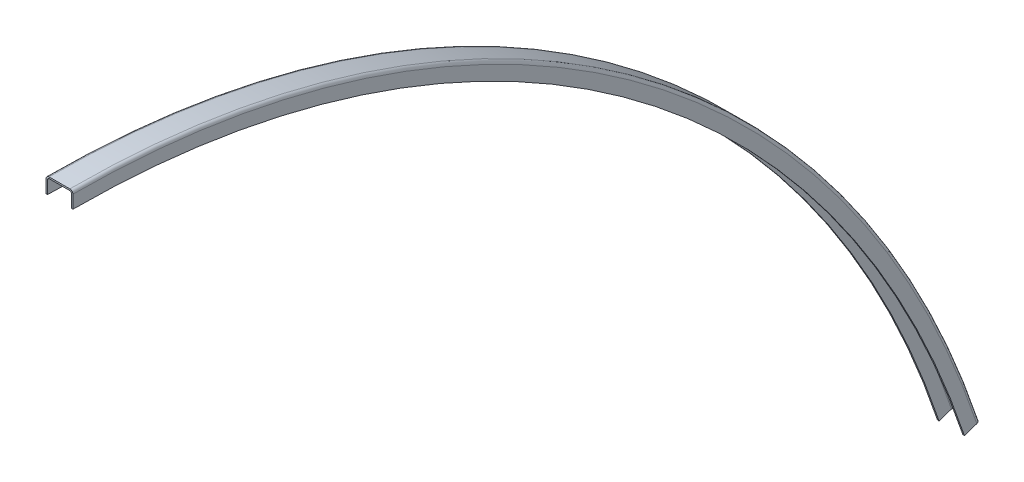
from build123d import *

# Parameters (mm, degrees)
REVOLVE1_ANGLE = 71.5


with BuildPart() as part:
    # Sketch1 → Revolve1 (revolve)
    with BuildSketch(Plane.XY):
        with BuildLine():
            Line((-23.203703704, 37.981481481), (-23.203703704, 54.981481481))
            ThreePointArc((-23.203703704, 54.981481481), (-22.032130828, 57.809908606), (-19.203703704, 58.981481481))
            Line((-19.203703704, 58.981481481), (7.796296296, 58.981481481))
            ThreePointArc((7.796296296, 58.981481481), (10.624723421, 57.809908606), (11.796296296, 54.981481481))
            Line((11.796296296, 54.981481481), (11.796296296, 37.981481481))
            Line((11.796296296, 37.981481481), (9.796296296, 37.981481481))
            Line((9.796296296, 37.981481481), (9.796296296, 54.981481481))
            ThreePointArc((9.796296296, 54.981481481), (9.210509859, 56.395695044), (7.796296296, 56.981481481))
            Line((7.796296296, 56.981481481), (-19.203703704, 56.981481481))
            ThreePointArc((-19.203703704, 56.981481481), (-20.617917266, 56.395695044), (-21.203703704, 54.981481481))
            Line((-21.203703704, 54.981481481), (-21.203703704, 37.981481481))
            Line((-21.203703704, 37.981481481), (-23.203703704, 37.981481481))
        make_face()
    revolve(axis=Axis((14.479414078, -1185.518518519, 0), (-1, 0, 0)), revolution_arc=REVOLVE1_ANGLE)


solid = part.part
